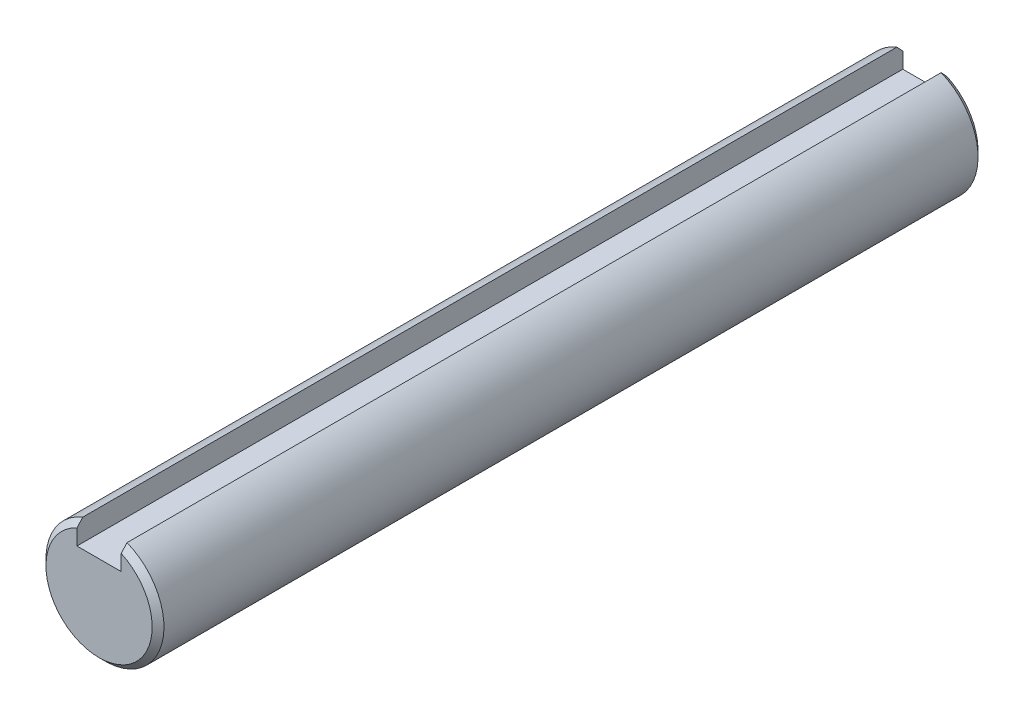
from build123d import *

# Parameters (mm, degrees)
BOSS_EXTRUDE2_DEPTH      = 25.4
BOSS_EXTRUDE2_DEPTH_BACK = 19.05
SKETCH3_R                = 3.175
CUT_EXTRUDE5_DEPTH       = 26.793821935
CUT_EXTRUDE5_DEPTH_BACK  = 26.793821935
SKETCH10_W               = 2.38125
SKETCH10_H               = 1.422321225
CHAMFER1_SIZE            = 0.3175


with BuildPart() as part:
    # Sketch3 → Boss-Extrude2 (new, two sides: drawn at the far end of the back side and taken through both)
    with BuildSketch(Plane.XY.offset(-BOSS_EXTRUDE2_DEPTH_BACK)):
        Circle(SKETCH3_R)
    extrude(amount=BOSS_EXTRUDE2_DEPTH + BOSS_EXTRUDE2_DEPTH_BACK)

    # Sketch10 → Cut-Extrude5 (cut, two sides: drawn at the far end of the back side and taken through both)
    with BuildSketch(Plane.XY.offset(-CUT_EXTRUDE5_DEPTH_BACK)):
        with Locations((0, 2.463839388)):
            Rectangle(SKETCH10_W, SKETCH10_H)
    extrude(amount=CUT_EXTRUDE5_DEPTH + CUT_EXTRUDE5_DEPTH_BACK, mode=Mode.SUBTRACT)

    # Chamfer1
    chamfer1_edges = [part.edges().sort_by_distance(p)[0] for p in [
        (0, -3.175, -19.05),
        (0, -3.175, 25.4),
    ]]
    chamfer(chamfer1_edges, length=CHAMFER1_SIZE)


solid = part.part
